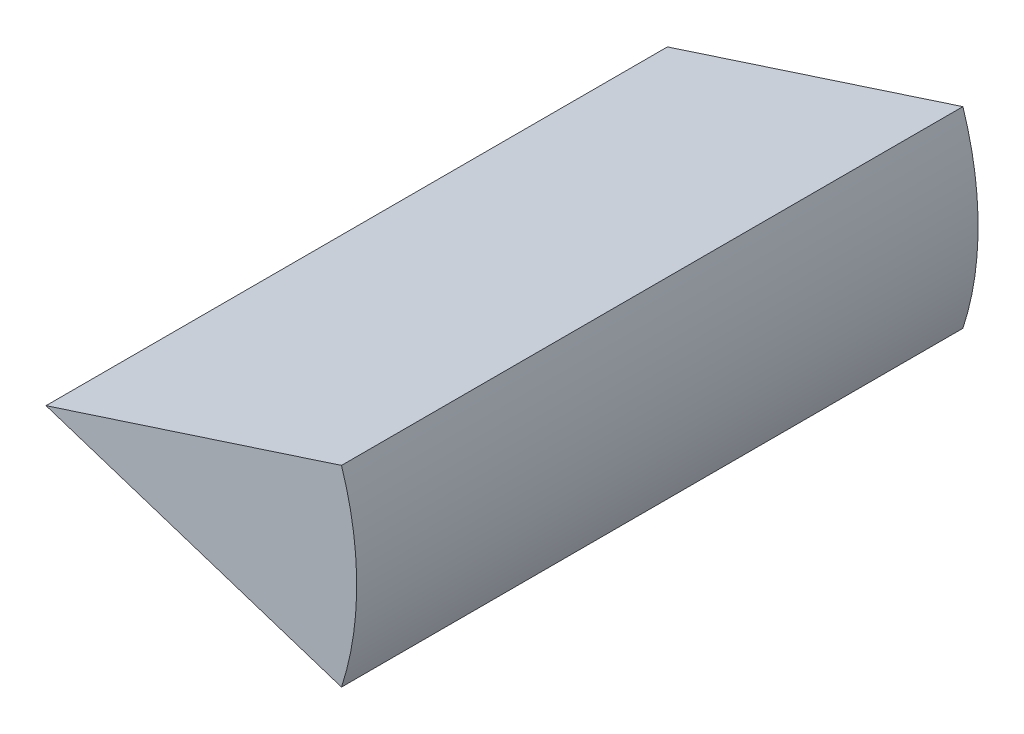
from build123d import *

# Parameters (mm, degrees)
SALIENTE_EXTRUIR1_DEPTH = 50
CROQUIS2_R              = 4.965671832
CORTAR_EXTRUIR1_DEPTH   = 10


with BuildPart() as part:
    # Croquis1 → Saliente-Extruir1 (new body)
    with BuildSketch(Plane.XY):
        with BuildLine():
            Line((0, 0), (23.776412907, 7.725424859))
            ThreePointArc((23.776412907, 7.725424859), (25, 0), (23.776412907, -7.725424859))
            Line((23.776412907, -7.725424859), (0, 0))
        make_face()
    extrude(amount=SALIENTE_EXTRUIR1_DEPTH)

    # Croquis2 → Cortar-Extruir1 (cut)
    with BuildSketch(Plane(origin=(0, 0, 0), x_dir=(-1, 0, 0), z_dir=(0, 0, -1))):
        with Locations((-19.11388098, 0.455622912)):
            Circle(CROQUIS2_R)
    extrude(amount=-CORTAR_EXTRUIR1_DEPTH, mode=Mode.SUBTRACT)


solid = part.part
